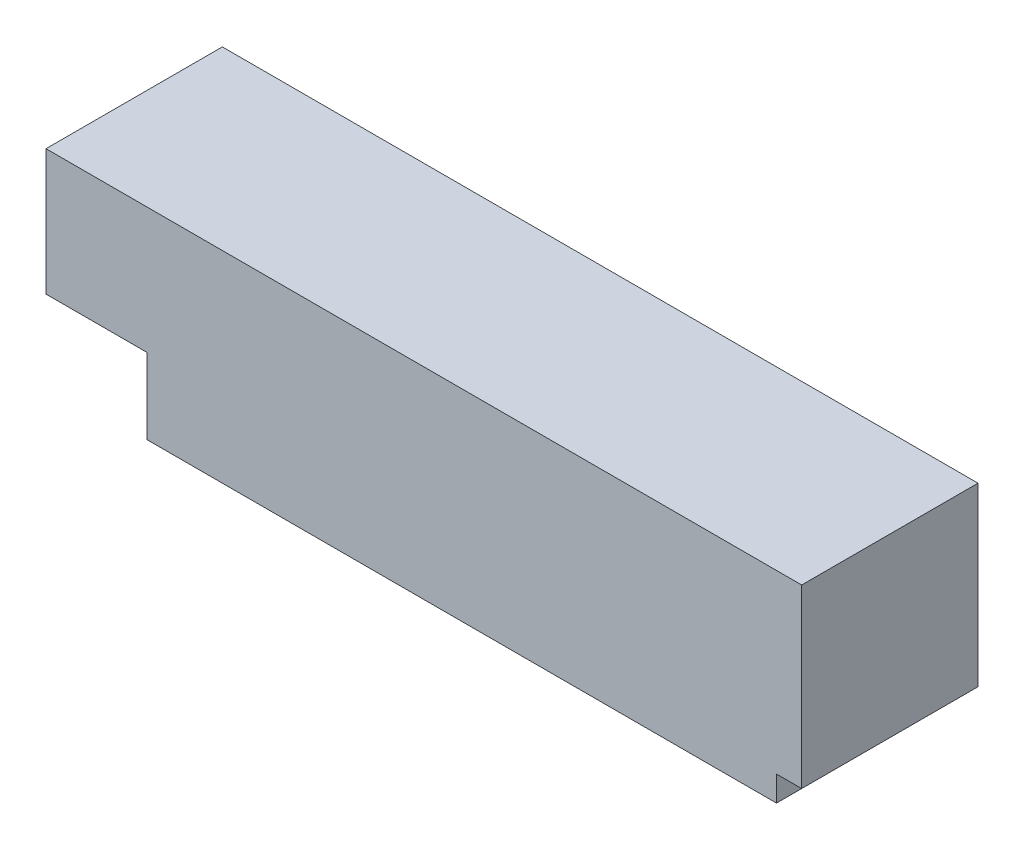
from build123d import *

# Parameters (mm, degrees)
SALIENTE_EXTRUIR1_DEPTH = 7


with BuildPart() as part:
    # Croquis1 → Saliente-Extruir1 (new body)
    with BuildSketch(Plane.XY):
        Polygon((0, 0), (0, 3), (-4, 3), (-4, 8), (3.306646596, 8), (26, 8), (26, 1), (25, 1), (25, 0), align=None)
    extrude(amount=SALIENTE_EXTRUIR1_DEPTH)


solid = part.part
